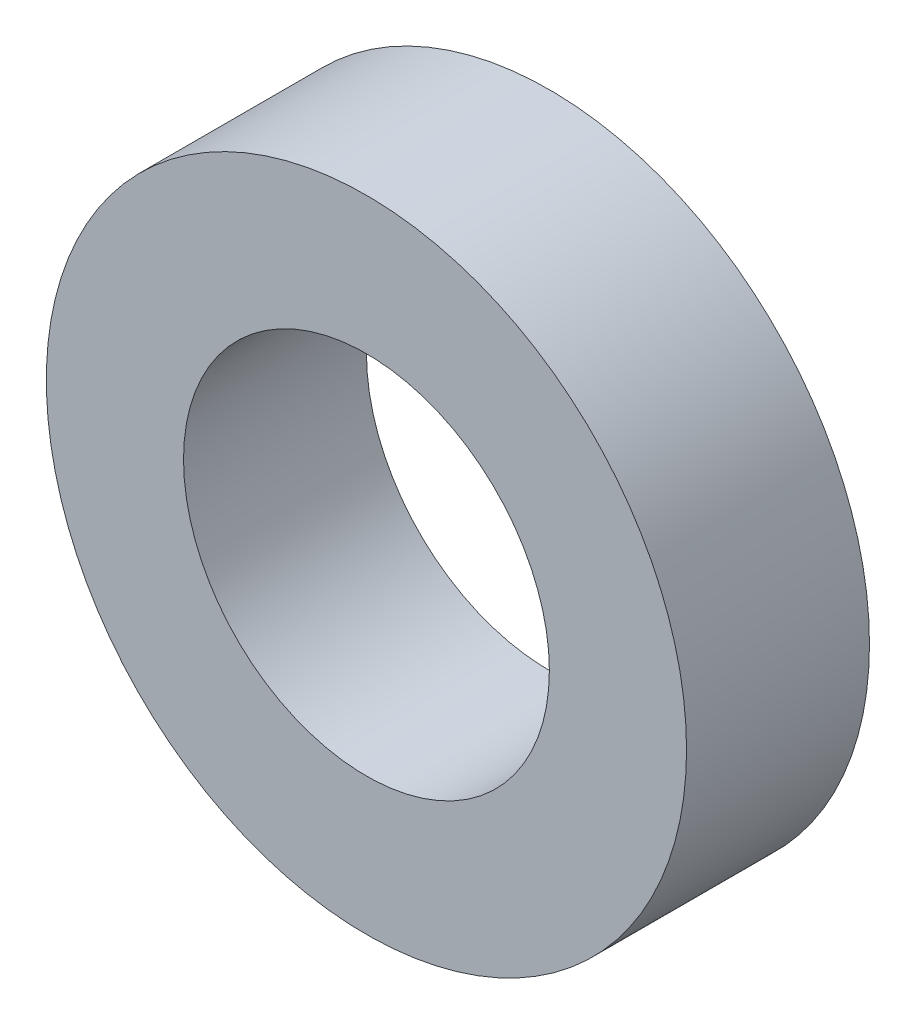
from build123d import *

# Parameters (mm, degrees)
SKETCH_1_R      = 7
SKETCH_1_R_2    = 4
EXTRUDE_1_DEPTH = 2


with BuildPart() as part:
    # 草图1 → 凸台-拉伸1 (new, symmetric)
    with BuildSketch(Plane.XY):
        Circle(SKETCH_1_R)
        Circle(SKETCH_1_R_2, mode=Mode.SUBTRACT)
    extrude(amount=EXTRUDE_1_DEPTH, both=True)


solid = part.part
